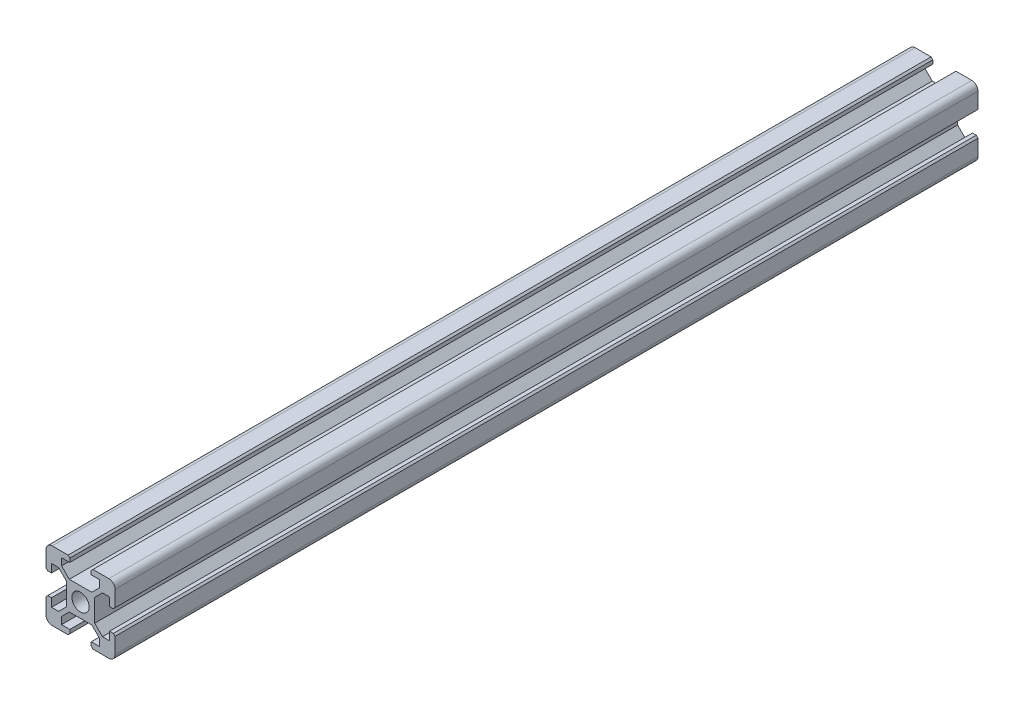
from build123d import *

# Parameters (mm, degrees)
BOSS_EXTRUDE1_DEPTH = 125


with BuildPart() as part:
    # Sketch1 → Boss-Extrude1 (new, symmetric)
    with BuildSketch(Plane.XY):
        with BuildLine():
            Line((0, 4.1), (3.251471863, 4.1))
            Line((3.251471863, 4.1), (5.5, 6.348528137))
            Line((5.5, 6.348528137), (5.5, 8.4))
            Line((5.5, 8.4), (3.1, 8.4))
            Line((3.1, 8.4), (3.1, 9.5))
            Line((3.1, 9.5), (3.6, 10))
            Line((3.6, 10), (8.209994734, 10))
            ThreePointArc((8.209994734, 10), (8.895000093, 9.863743962), (9.475719596, 9.475719596))
            Line((9.475719596, 9.475719596), (1.767766953, 1.767766953))
            ThreePointArc((1.767766953, 1.767766953), (0.956708581, 2.309698831), (0, 2.5))
            Line((0, 2.5), (0, 4.1))
        make_face()
    extrude(amount=BOSS_EXTRUDE1_DEPTH, both=True)

    # Mirror1: part across plane


with BuildPart() as part_1:
    add(part.part)
    add(part.part.mirror(Plane(origin=(1.767766953, 1.767766953, 125), x_dir=(0, 0, 1), z_dir=(-0.7071067811865499, 0.7071067811865451, 0))))

    # Mirror2: part across plane


with BuildPart() as part_2:
    add(part_1.part)
    add(part_1.part.mirror(Plane(origin=(0, 4.1, 125), x_dir=(0, 0, 1), z_dir=(1, 0, 0))))

    # Mirror3: part across plane


with BuildPart() as part_3:
    add(part_2.part)
    add(part_2.part.mirror(Plane(origin=(-4.1, 0, 125), x_dir=(0, 0, 1), z_dir=(0, 1, 0))))


solid = part_3.part
